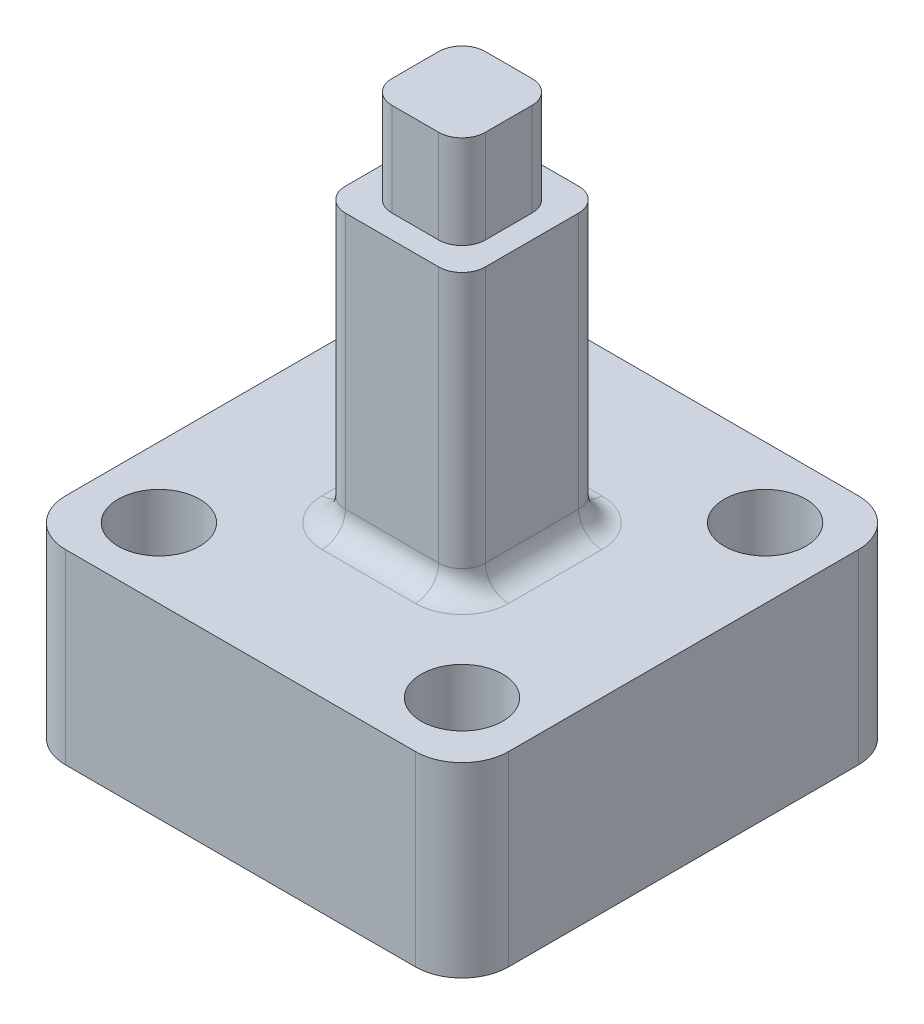
from build123d import *

# Parameters (mm, degrees)
SKETCH1_W           = 19
SKETCH1_H           = 19
BOSS_EXTRUDE1_DEPTH = 8
SKETCH2_R           = 1.75
CUT_EXTRUDE1_DEPTH  = 16.636495771
SKETCH3_W           = 6
SKETCH3_H           = 6
BOSS_EXTRUDE2_DEPTH = 12
FILLET1_R           = 2
SKETCH5_W           = 4
SKETCH5_H           = 4
BOSS_EXTRUDE4_DEPTH = 4
FILLET3_R           = 1


with BuildPart() as part:
    # Sketch1 → Boss-Extrude1 (new body)
    with BuildSketch(Plane(origin=(0, 0, 0), x_dir=(1, 0, 0), z_dir=(0, 1, 0))):
        Rectangle(SKETCH1_W, SKETCH1_H)
    extrude(amount=BOSS_EXTRUDE1_DEPTH)

    # Sketch2 → Cut-Extrude1 (cut, through all)
    with BuildSketch(Plane(origin=(0, 8, 0), x_dir=(1, 0, 0), z_dir=(0, 1, 0))):
        with Locations(Location((-6.5, 6.5, 0), (0, 0, 270))):
            Circle(SKETCH2_R)
        with Locations(Location((6.5, 6.5, 0), (0, 0, 270))):
            Circle(SKETCH2_R)
        with Locations(Location((-6.5, -6.5, 0), (0, 0, 270))):
            Circle(SKETCH2_R)
        with Locations(Location((6.5, -6.5, 0), (0, 0, 270))):
            Circle(SKETCH2_R)
    extrude(amount=-CUT_EXTRUDE1_DEPTH, mode=Mode.SUBTRACT)

    # Sketch3 → Boss-Extrude2 (add)
    with BuildSketch(Plane(origin=(0, 8, 0), x_dir=(1, 0, 0), z_dir=(0, 1, 0))):
        Rectangle(SKETCH3_W, SKETCH3_H)
    extrude(amount=BOSS_EXTRUDE2_DEPTH)

    # Fillet1
    fillet1_edges = [part.edges().sort_by_distance(p)[0] for p in [
        (-9.5, 4, -9.5),
        (9.5, 4, -9.5),
        (9.5, 4, 9.5),
        (-9.5, 4, 9.5),
    ]]
    fillet(fillet1_edges, radius=FILLET1_R)

    # Sketch5 → Boss-Extrude4 (add)
    with BuildSketch(Plane(origin=(0, 20, 0), x_dir=(1, 0, 0), z_dir=(0, 1, 0))):
        Rectangle(SKETCH5_W, SKETCH5_H)
    extrude(amount=BOSS_EXTRUDE4_DEPTH)

    # Fillet3
    fillet3_edges = [part.edges().sort_by_distance(p)[0] for p in [
        (-3, 8, 0),
        (-3, 14, -3),
        (0, 8, 3),
        (-3, 14, 3),
        (3, 8, 0),
        (3, 14, 3),
        (0, 8, -3),
        (3, 14, -3),
        (-2, 22, -2),
        (-2, 22, 2),
        (2, 22, 2),
        (2, 22, -2),
    ]]
    fillet(fillet3_edges, radius=FILLET3_R)


solid = part.part
